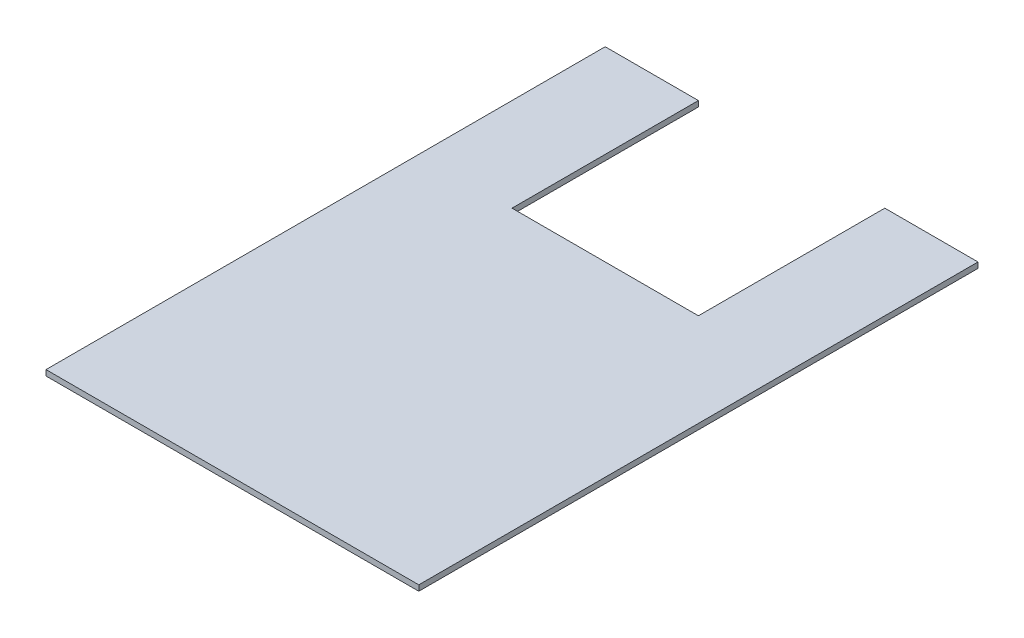
from build123d import *

# Parameters (mm, degrees)
SKETCH1_W           = 200
SKETCH1_H           = 300
BOSS_EXTRUDE1_DEPTH = 3
CUT_EXTRUDE1_DEPTH  = 181.302523554


with BuildPart() as part:
    # Sketch1 → Boss-Extrude1 (new body)
    with BuildSketch(Plane(origin=(0, 0, 0), x_dir=(1, 0, 0), z_dir=(0, 1, 0))):
        Rectangle(SKETCH1_W, SKETCH1_H)
    extrude(amount=BOSS_EXTRUDE1_DEPTH)

    # Sketch3 → Cut-Extrude1 (cut, through all)
    with BuildSketch(Plane(origin=(0, 3, 0), x_dir=(1, 0, 0), z_dir=(0, 1, 0))):
        Polygon((0, 150), (50, 150), (50, 50), (-50, 50), (-50, 150), align=None)
    extrude(amount=-CUT_EXTRUDE1_DEPTH, mode=Mode.SUBTRACT)


solid = part.part
